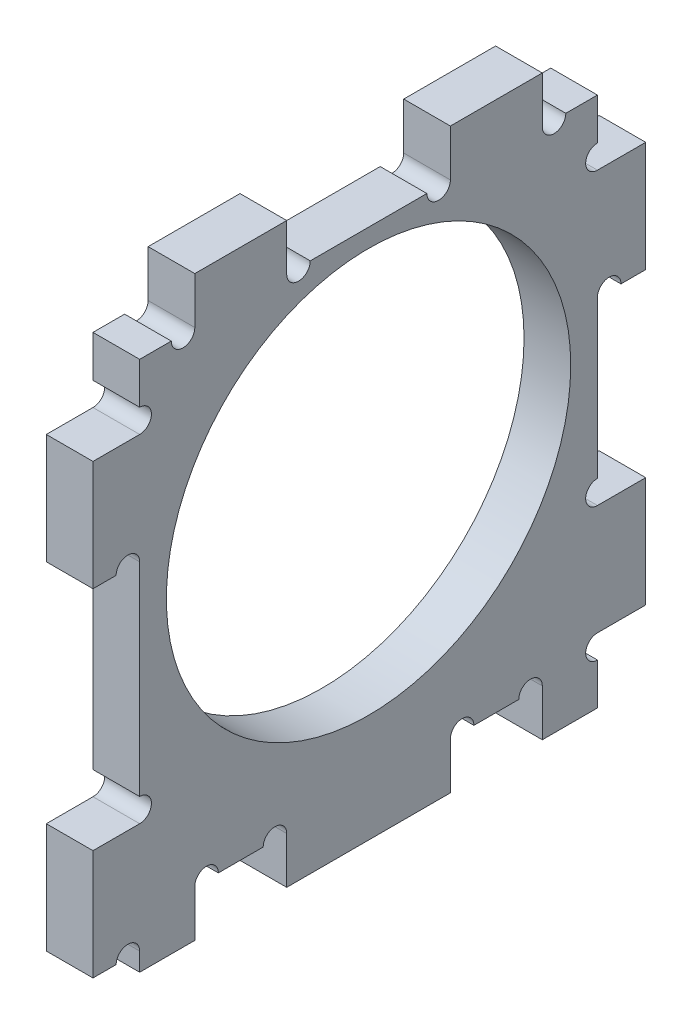
from build123d import *

# Parameters (mm, degrees)
SKETCH1_R           = 55
BOSS_EXTRUDE1_DEPTH = 12.7
SKETCH2_R           = 3.2
CUT_EXTRUDE1_DEPTH  = 114.880942125


with BuildPart() as part:
    # Sketch1 → Boss-Extrude1 (new body)
    with BuildSketch(Plane(origin=(0, 0, 0), x_dir=(0, 0, -1), z_dir=(1, 0, 0))):
        Polygon((-62.262586226, 60), (-62.262586226, 42.3), (-74.962586226, 42.3), (-74.962586226, 12.3), (-62.262586226, 12.3), (-62.262586226, -49.4), (-74.962586226, -49.4), (-74.962586226, -79.4), (-62.262586226, -79.4), (-62.262586226, -84.4), (-47.262586226, -84.4), (-47.262586226, -71.7), (-22.262586226, -71.7), (-22.262586226, -84.4), (22.262586226, -84.4), (22.262586226, -71.7), (47.262586226, -71.7), (47.262586226, -84.4), (62.262586226, -84.4), (62.262586226, -66.7), (75.393759552, -66.7), (75.393759552, -36.7), (62.262586226, -36.7), (62.262586226, 12.3), (75.393759552, 12.3), (75.393759552, 42.3), (62.262586226, 42.3), (62.262586226, 60), (47.262586226, 60), (47.262586226, 72.7), (22.262586226, 72.7), (22.262586226, 60), (0, 60), (-22.262586226, 60), (-22.262586226, 72.7), (-47.262586226, 72.7), (-47.262586226, 60), align=None)
        Circle(SKETCH1_R, mode=Mode.SUBTRACT)
    extrude(amount=BOSS_EXTRUDE1_DEPTH)

    # Sketch2 → Cut-Extrude1 (cut, through all)
    with BuildSketch(Plane(origin=(12.7, 0, 0), x_dir=(0, 0, -1), z_dir=(1, 0, 0))):
        with Locations((-62.262586226, 45.5)):
            Circle(SKETCH2_R)
        with Locations((-65.462586226, 12.3)):
            Circle(SKETCH2_R)
        with Locations((-62.262586226, -46.2)):
            Circle(SKETCH2_R)
        with Locations((-65.462586226, -79.4)):
            Circle(SKETCH2_R)
        with Locations((62.262586226, -69.9)):
            Circle(SKETCH2_R)
        with Locations((62.262586226, -33.5)):
            Circle(SKETCH2_R)
        with Locations((65.462586226, 12.3)):
            Circle(SKETCH2_R)
        with Locations((62.262586226, 45.5)):
            Circle(SKETCH2_R)
        with Locations((-50.462586226, 60)):
            Circle(SKETCH2_R)
        with Locations((-19.062586226, 60)):
            Circle(SKETCH2_R)
        with Locations((19.062586226, 60)):
            Circle(SKETCH2_R)
        with Locations((50.462586226, 60)):
            Circle(SKETCH2_R)
        with Locations((-44.062586226, -71.7)):
            Circle(SKETCH2_R)
        with Locations((-25.462586226, -71.7)):
            Circle(SKETCH2_R)
        with Locations((25.462586226, -71.7)):
            Circle(SKETCH2_R)
        with Locations((44.062586226, -71.7)):
            Circle(SKETCH2_R)
    extrude(amount=-CUT_EXTRUDE1_DEPTH, mode=Mode.SUBTRACT)


solid = part.part
